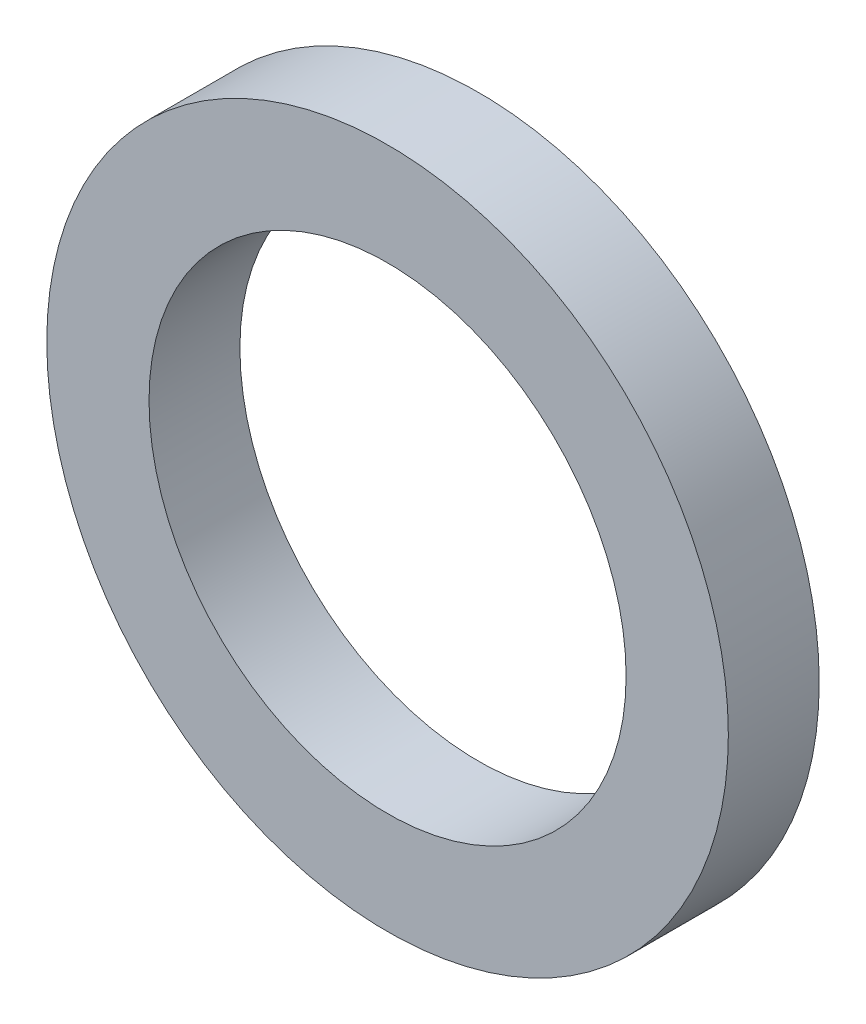
from build123d import *

# Parameters (mm, degrees)
SKETCH_1_R      = 30
SKETCH_1_R_2    = 21
EXTRUDE_1_DEPTH = 4


with BuildPart() as part:
    # 草图1 → 凸台-拉伸1 (new, symmetric)
    with BuildSketch(Plane.XY):
        Circle(SKETCH_1_R)
        Circle(SKETCH_1_R_2, mode=Mode.SUBTRACT)
    extrude(amount=EXTRUDE_1_DEPTH, both=True)


solid = part.part
